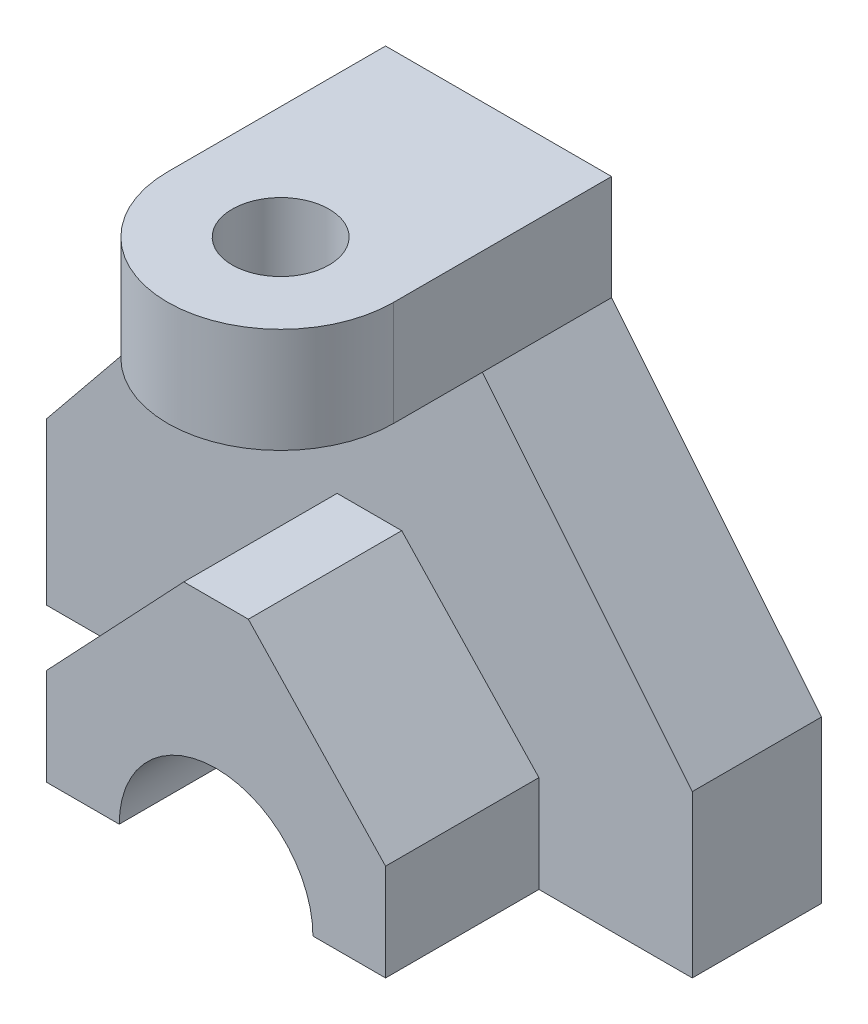
from build123d import *

# Parameters (mm, degrees)
EXTRUDE_1_DEPTH     = 16
EXTRUDE_2_DEPTH     = 13
SKETCH_4_R          = 6
CUT_EXTRUDE_1_DEPTH = 13
EXTRUDE_3_DEPTH     = 19
CUT_EXTRUDE_2_DEPTH = 35


with BuildPart() as part:
    # 草图1 → 凸台-拉伸1 (new body)
    with BuildSketch(Plane.XY):
        Polygon((0, 0), (-40, 0), (-40, 20), (-14, 52), (0, 52), align=None)
    extrude_1 = extrude(amount=EXTRUDE_1_DEPTH)

    # 镜向1: 凸台-拉伸1 across plane
    add(extrude_1.mirror(Plane(origin=(0, 0, 16), x_dir=(0, 0, 1), z_dir=(-1, 0, 0))))

    # 草图3 → 凸台-拉伸2 (add)
    with BuildSketch(Plane(origin=(0, 52, 0), x_dir=(1, 0, 0), z_dir=(0, 1, 0))):
        with BuildLine():
            Line((-14, 0), (-14, -27))
            ThreePointArc((-14, -27), (0, -41), (14, -27))
            Line((14, -27), (14, 0))
            Line((14, 0), (-14, 0))
        make_face()
    extrude(amount=EXTRUDE_2_DEPTH)

    # 草图4 → 切除-拉伸1 (cut)
    with BuildSketch(Plane(origin=(0, 65, 0), x_dir=(1, 0, 0), z_dir=(0, 1, 0))):
        with Locations(Location((0, -27, 0), (0, 0, 270))):
            Circle(SKETCH_4_R)
    extrude(amount=-CUT_EXTRUDE_1_DEPTH, mode=Mode.SUBTRACT)

    # 草图5 → 凸台-拉伸3 (add)
    with BuildSketch(Plane.XY.offset(16)):
        Polygon((0, 0), (-21, 0), (-21, 12), (-4, 30), (0, 30), align=None)
    extrude_3 = extrude(amount=EXTRUDE_3_DEPTH)

    # 镜向2: 凸台-拉伸3 across plane
    add(extrude_3.mirror(Plane(origin=(0, 0, 35), x_dir=(0, 0, 1), z_dir=(-1, 0, 0))))

    # 草图6 → 切除-拉伸2 (cut)
    with BuildSketch(Plane.XY.offset(35)):
        with BuildLine():
            Line((-12, 0), (12, 0))
            ThreePointArc((12, 0), (0, 12), (-12, 0))
        make_face()
    extrude(amount=-CUT_EXTRUDE_2_DEPTH, mode=Mode.SUBTRACT)


solid = part.part
